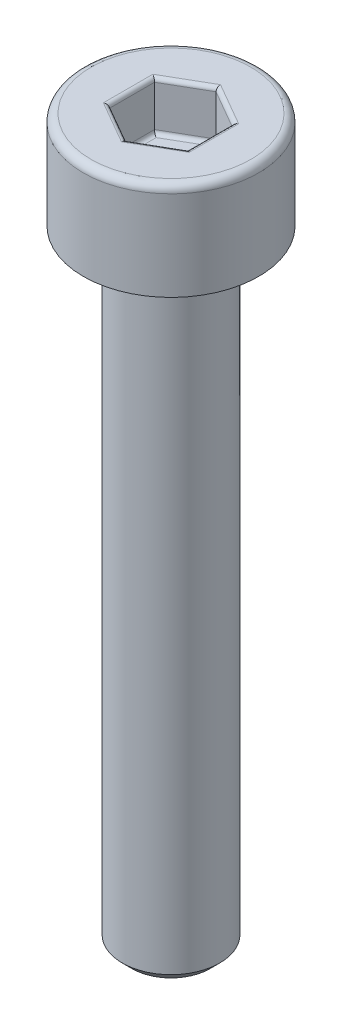
from build123d import *

# Parameters (mm, degrees)
CHAMFER1_SIZE      = 0.25
FILLET1_R          = 0.2
CUT_EXTRUDE1_DEPTH = 1.25
FILLET2_R          = 0.1


with BuildPart() as part:
    # Sketch1 → Revolve1 (revolve)
    with BuildSketch(Plane.XY, mode=Mode.PRIVATE) as revolve1_sk:
        Polygon((0, -18.5), (-1.25, -18.5), (-1.25, -2.5), (-2.25, -2.5), (-2.25, 0), (0, 0), align=None)
    revolve(revolve1_sk.sketch.rotate(Axis((0, 0, 0), (0, -1, 0)), 270), axis=Axis((0, 0, 0), (0, -1, 0)))

    # Chamfer1
    chamfer1_edges = [part.edges().sort_by_distance(p)[0] for p in [
        (0, -2.5, -1.25),
        (0, -18.5, -1.25),
    ]]
    chamfer(chamfer1_edges, length=CHAMFER1_SIZE)

    # Fillet1
    fillet1_edges = [part.edges().sort_by_distance(p)[0] for p in [
        (0, 0, -2.25),
    ]]
    fillet(fillet1_edges, radius=FILLET1_R)

    # Sketch2 → Cut-Extrude1 (cut)
    with BuildSketch(Plane(origin=(0, 0, 0), x_dir=(1, 0, 0), z_dir=(0, 1, 0))):
        Polygon((0, 1.154700538), (-1, 0.577350269), (-1, -0.577350269), (0, -1.154700538), (1, -0.577350269), (1, 0.577350269), align=None)
    extrude(amount=-CUT_EXTRUDE1_DEPTH, mode=Mode.SUBTRACT)

    # Fillet2
    fillet2_edges = [part.edges().sort_by_distance(p)[0] for p in [
        (0.5, -1.25, -0.866025404),
        (1, -1.25, 0),
        (0.5, -1.25, 0.866025404),
        (-0.5, -1.25, 0.866025404),
        (-1, -1.25, 0),
        (-0.5, -1.25, -0.866025404),
        (0.4999999999999987, 0, -0.8660254037844397),
        (-0.5000000000000006, 0, -0.8660254037844395),
        (-1, 0, 0),
        (-0.5000000000000007, 0, 0.8660254037844379),
        (0.4999999999999988, 0, 0.8660254037844382),
        (1, 0, 0),
    ]]
    fillet(fillet2_edges, radius=FILLET2_R)


solid = part.part
